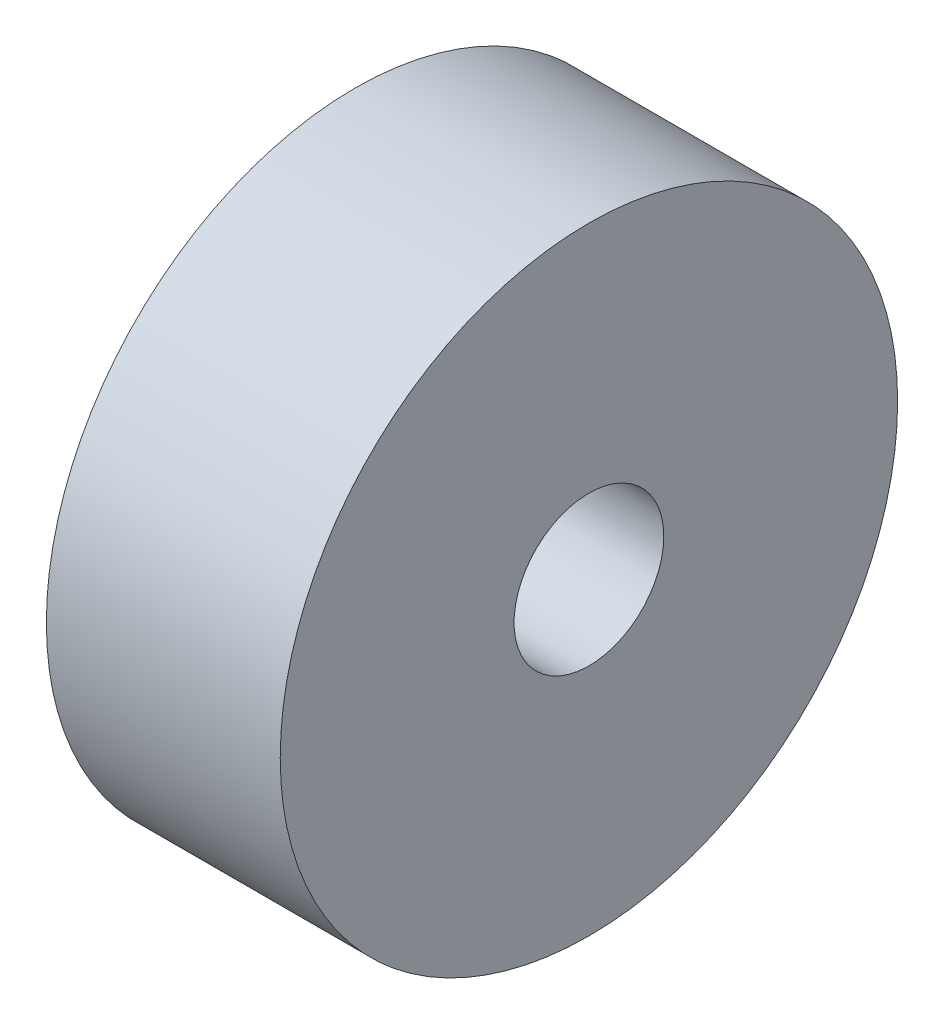
from build123d import *

# Parameters (mm, degrees)
SKETCH_1_R               = 33
EXTRUDE_2_DEPTH          = 25
CUT_EXTRUDE_3_DEPTH      = 53.943365968
CUT_EXTRUDE_3_DEPTH_BACK = 53.943365968
SKETCH_3_R               = 8


with BuildPart() as part:
    # 스케치1 → 보스-돌출2 (new body)
    with BuildSketch(Plane(origin=(0, 0, 0), x_dir=(0, 0, -1), z_dir=(1, 0, 0))):
        Circle(SKETCH_1_R)
    extrude(amount=EXTRUDE_2_DEPTH)

    # 스케치3 → 컷-돌출3 (cut, two sides: drawn at the far end of the back side and taken through both)
    with BuildSketch(Plane(origin=(0, 0, 0), x_dir=(0, 0, -1), z_dir=(1, 0, 0)).offset(-CUT_EXTRUDE_3_DEPTH_BACK)):
        Circle(SKETCH_3_R)
    extrude(amount=CUT_EXTRUDE_3_DEPTH + CUT_EXTRUDE_3_DEPTH_BACK, mode=Mode.SUBTRACT)


solid = part.part
